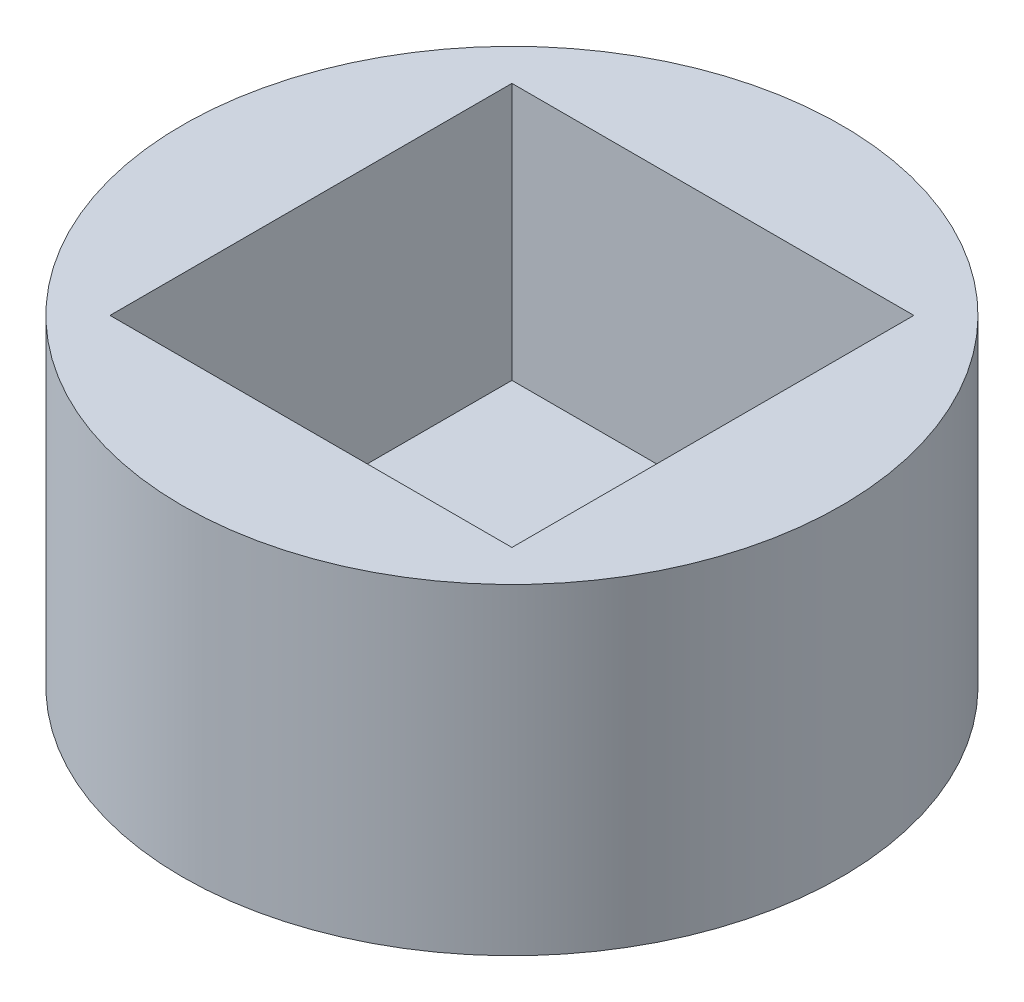
from build123d import *

# Parameters (mm, degrees)
SKETCH1_R           = 26.035
BOSS_EXTRUDE1_DEPTH = 25.4
SKETCH2_W           = 31.75
SKETCH2_H           = 31.75
CUT_EXTRUDE1_DEPTH  = 20.32


with BuildPart() as part:
    # Sketch1 → Boss-Extrude1 (new body)
    with BuildSketch(Plane(origin=(0, 0, 0), x_dir=(1, 0, 0), z_dir=(0, 1, 0))):
        with Locations(Location((0, 0, 0), (0, 0, 270))):
            Circle(SKETCH1_R)
    extrude(amount=BOSS_EXTRUDE1_DEPTH)

    # Sketch2 → Cut-Extrude1 (cut)
    with BuildSketch(Plane(origin=(0, 25.4, 0), x_dir=(1, 0, 0), z_dir=(0, 1, 0))):
        Rectangle(SKETCH2_W, SKETCH2_H)
    extrude(amount=-CUT_EXTRUDE1_DEPTH, mode=Mode.SUBTRACT)


solid = part.part
